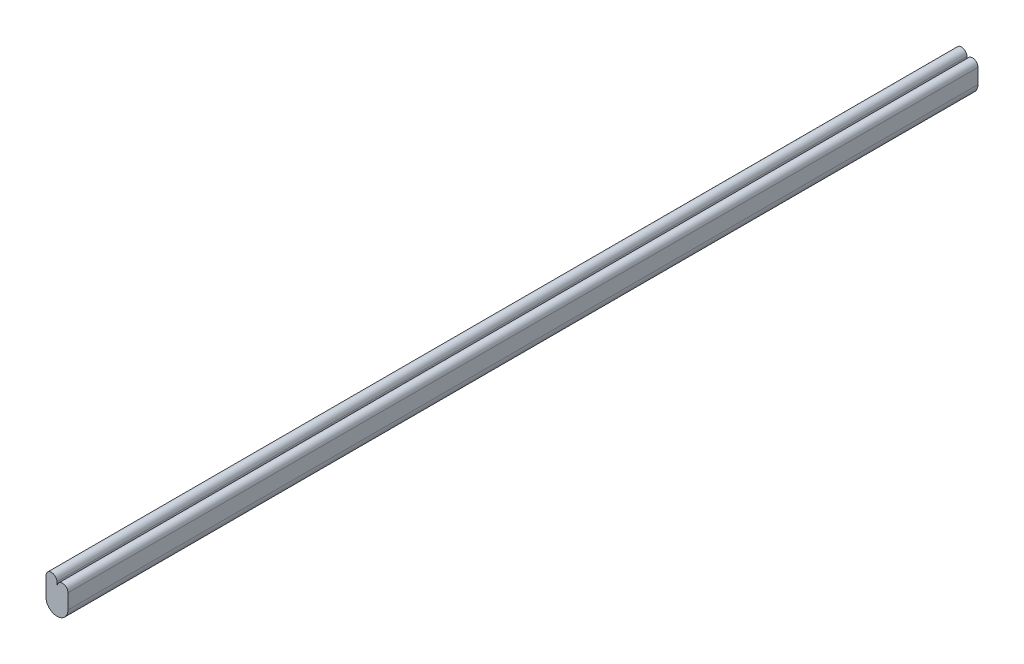
from build123d import *

# Parameters (mm, degrees)
BOSS_EXTRUDE4_DEPTH = 580


with BuildPart() as part:
    # Sketch1 → Boss-Extrude4 (new body)
    with BuildSketch(Plane.XY):
        with BuildLine():
            Line((-0.05, 12.024999955), (-0.05, 0))
            ThreePointArc((-0.05, 0), (0, -0.05), (0.05, 0))
            Line((0.05, 0), (0.05, 9.524999955))
            ThreePointArc((0.05, 9.524999955), (3.525000015, 12.99999997), (7.00000003, 9.524999955))
            Line((7.00000003, 9.524999955), (7.00000003, 0))
            ThreePointArc((7.00000003, 0), (0, -7.00000003), (-7.00000003, 0))
            Line((-7.00000003, 0), (-7.00000003, 12.024999955))
            ThreePointArc((-7.00000003, 12.024999955), (-3.525000015, 15.49999997), (-0.05, 12.024999955))
        make_face()
    extrude(amount=BOSS_EXTRUDE4_DEPTH)


solid = part.part
